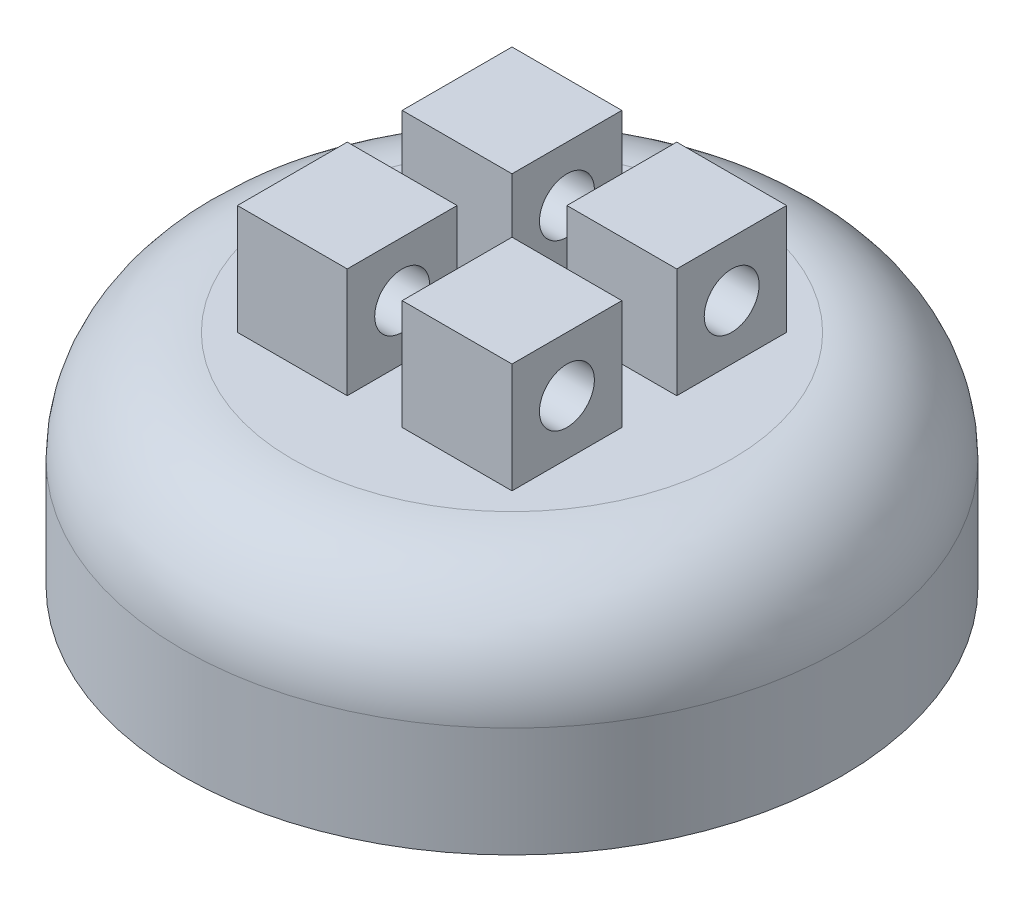
from build123d import *

# Parameters (mm, degrees)
SKETCH2_R           = 76.2
BOSS_EXTRUDE2_DEPTH = 50.8
FILLET1_R           = 25.4
SKETCH3_W           = 25.4
SKETCH3_H           = 25.4
BOSS_EXTRUDE3_DEPTH = 25.4
CUT_EXTRUDE2_REACH  = 154.532
SKETCH5_R           = 6.35
CUT_EXTRUDE3_REACH  = 154.532
SKETCH6_R           = 6.35


with BuildPart() as part:
    # Sketch2 → Boss-Extrude2 (new body)
    with BuildSketch(Plane(origin=(0, 0, 0), x_dir=(1, 0, 0), z_dir=(0, 1, 0))):
        with Locations(Location((0, 0, 0), (0, 0, 270))):
            Circle(SKETCH2_R)
    extrude(amount=BOSS_EXTRUDE2_DEPTH)

    # Fillet1
    fillet1_edges = [part.edges().sort_by_distance(p)[0] for p in [
        (0, 50.8, -76.2),
    ]]
    fillet(fillet1_edges, radius=FILLET1_R)

    # Sketch3 → Boss-Extrude3 (add)
    with BuildSketch(Plane(origin=(0, 50.8, 0), x_dir=(1, 0, 0), z_dir=(0, 1, 0))):
        with Locations((-19.05, 19.05)):
            Rectangle(SKETCH3_W, SKETCH3_H)
        with Locations((19.05, 19.05)):
            Rectangle(SKETCH3_W, SKETCH3_H)
        with Locations((-19.05, -19.05)):
            Rectangle(SKETCH3_W, SKETCH3_H)
        with Locations((19.05, -19.05)):
            Rectangle(SKETCH3_W, SKETCH3_H)
    extrude(amount=BOSS_EXTRUDE3_DEPTH)

    # Cut-Extrude2: up to this face of the body (flat: up to its plane)
    cut_extrude2_end = Plane(part.part.faces().sort_by_distance((31.75, 63.5, -19.05))[0])
    # Sketch5 → Cut-Extrude2 (cut, up to the picked face)
    with BuildSketch(Plane.ZY.offset(31.75), mode=Mode.PRIVATE) as cut_extrude2_sk1:
        with Locations((-19.05, 63.5)):
            Circle(SKETCH5_R)
    cut_extrude2_tool1 = split(extrude(cut_extrude2_sk1.sketch, amount=-CUT_EXTRUDE2_REACH, mode=Mode.PRIVATE), bisect_by=cut_extrude2_end, keep=Keep.BOTH, mode=Mode.PRIVATE)
    add(cut_extrude2_tool1.solids().sort_by(Axis((-31.75, 63.5, -19.05), (1, 0, 0)))[0], mode=Mode.SUBTRACT)

    # Cut-Extrude3: up to this face of the body (flat: up to its plane)
    cut_extrude3_end = Plane(part.part.faces().sort_by_distance((31.75, 63.5, 19.05))[0])
    # Sketch6 → Cut-Extrude3 (cut, up to the picked face)
    with BuildSketch(Plane.ZY.offset(31.75), mode=Mode.PRIVATE) as cut_extrude3_sk1:
        with Locations((19.05, 63.5)):
            Circle(SKETCH6_R)
    cut_extrude3_tool1 = split(extrude(cut_extrude3_sk1.sketch, amount=-CUT_EXTRUDE3_REACH, mode=Mode.PRIVATE), bisect_by=cut_extrude3_end, keep=Keep.BOTH, mode=Mode.PRIVATE)
    add(cut_extrude3_tool1.solids().sort_by(Axis((-31.75, 63.5, 19.05), (1, 0, 0)))[0], mode=Mode.SUBTRACT)


solid = part.part
